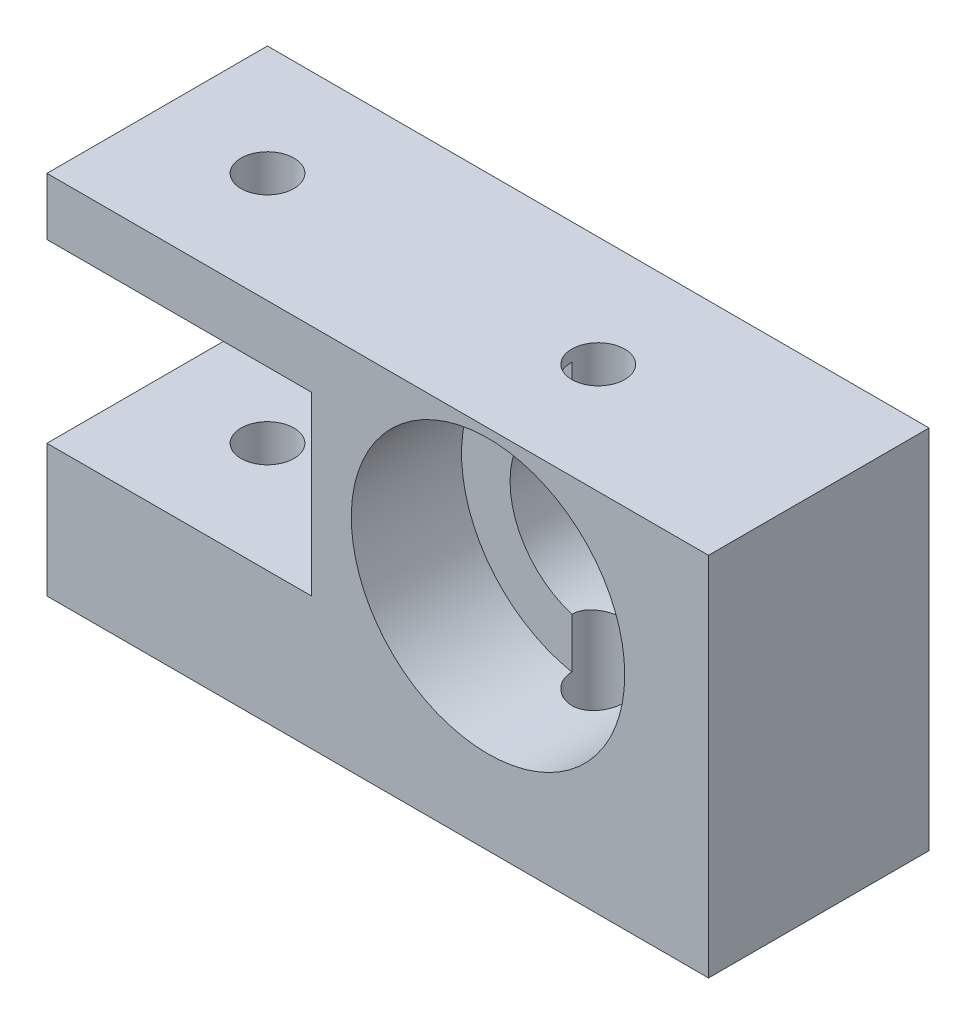
from build123d import *

# Parameters (mm, degrees)
SKETCH_1_W          = 20
SKETCH_1_H          = 10
SKETCH_1_R          = 3.1
EXTRUDE_1_DEPTH     = 2.5
SKETCH_2_W          = 20
SKETCH_2_H          = 10
EXTRUDE_2_DEPTH     = 2.5
SKETCH_3_R          = 0.6
CUT_EXTRUDE_1_DEPTH = 15.361406616
SKETCH_4_W          = 6
SKETCH_4_H          = 4
CUT_EXTRUDE_2_DEPTH = 13.247448796
SKETCH_5_R          = 2
CUT_EXTRUDE_3_DEPTH = 13.247448755
SKETCH_6_W          = 20
SKETCH_6_H          = 1.7
CUT_EXTRUDE_4_DEPTH = 13.247448796
SKETCH_7_W          = 5
SKETCH_7_H          = 8.3
CUT_EXTRUDE_5_DEPTH = 13.247448796


with BuildPart() as part:
    # 草图1 → 凸台-拉伸1 (new body)
    with BuildSketch(Plane.XY):
        Rectangle(SKETCH_1_W, SKETCH_1_H)
        Circle(SKETCH_1_R, mode=Mode.SUBTRACT)
    extrude(amount=EXTRUDE_1_DEPTH)

    # 草图2 → 凸台-拉伸2 (add)
    with BuildSketch(Plane(origin=(0, 0, 0), x_dir=(-1, 0, 0), z_dir=(0, 0, -1))):
        Rectangle(SKETCH_2_W, SKETCH_2_H)
    extrude(amount=EXTRUDE_2_DEPTH)

    # 草图3 → 切除-拉伸1 (cut, through all)
    with BuildSketch(Plane.XZ.offset(5)):
        with Locations((-7.5, 0)):
            Circle(SKETCH_3_R)
        Circle(SKETCH_3_R)
    extrude(amount=-CUT_EXTRUDE_1_DEPTH, mode=Mode.SUBTRACT)

    # 草图4 → 切除-拉伸2 (cut, through all)
    with BuildSketch(Plane(origin=(0, 0, -2.5), x_dir=(-1, 0, 0), z_dir=(0, 0, -1))):
        with Locations((7, 0)):
            Rectangle(SKETCH_4_W, SKETCH_4_H)
    extrude(amount=-CUT_EXTRUDE_2_DEPTH, mode=Mode.SUBTRACT)

    # 草图5 → 切除-拉伸3 (cut, through all)
    with BuildSketch(Plane.XY.offset(2.5)):
        Circle(SKETCH_5_R)
    extrude(amount=-CUT_EXTRUDE_3_DEPTH, mode=Mode.SUBTRACT)

    # 草图6 → 切除-拉伸4 (cut, through all)
    with BuildSketch(Plane.XY.offset(2.5)):
        with Locations((0, 4.15)):
            Rectangle(SKETCH_6_W, SKETCH_6_H)
    extrude(amount=-CUT_EXTRUDE_4_DEPTH, mode=Mode.SUBTRACT)

    # 草图7 → 切除-拉伸5 (cut, through all)
    with BuildSketch(Plane.XY.offset(2.5)):
        with Locations((7.5, -0.85)):
            Rectangle(SKETCH_7_W, SKETCH_7_H)
    extrude(amount=-CUT_EXTRUDE_5_DEPTH, mode=Mode.SUBTRACT)


solid = part.part
